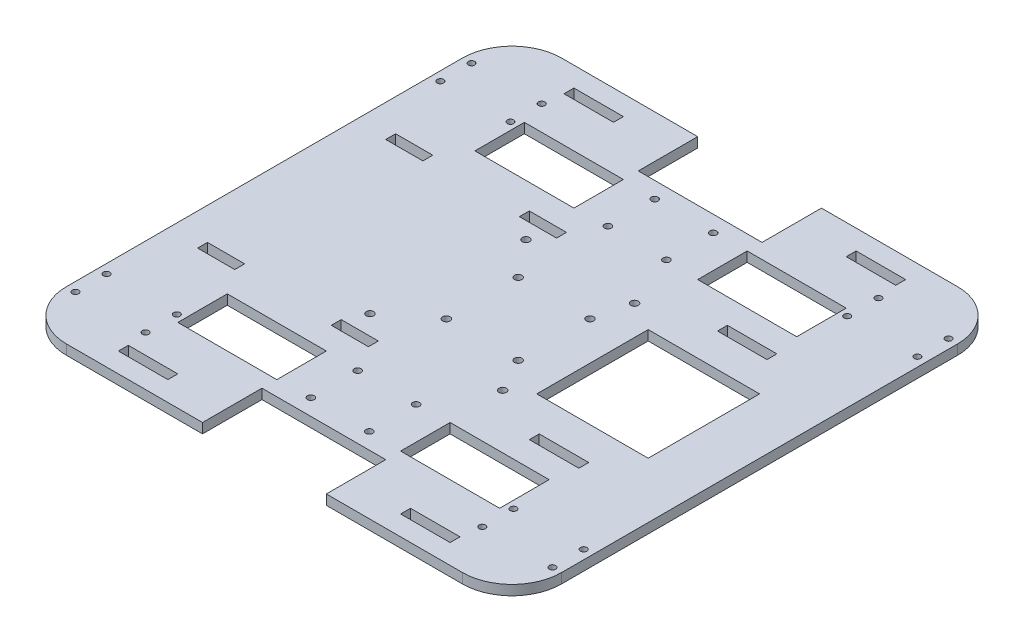
from build123d import *

# Parameters (mm, degrees)
SKETCH1_W               = 254
SKETCH1_H               = 254
PLATFORM_BASE_DEPTH     = 5.08
SKETCH9_W               = 25.4
SKETCH9_H               = 5.08
SKETCH9_W_2             = 19.05
CUT_EXTRUDE6_DEPTH      = 180.676950108
SKETCH3_R               = 1.75
CUT_EXTRUDE1_DEPTH      = 180.676950108
SKETCH4_W               = 63.5
SKETCH4_H               = 30.48
CUT_EXTRUDE2_DEPTH      = 180.676950108
CORNER_ROUNDING_R       = 25.4
SKETCH8_W               = 57.15
SKETCH8_H               = 57.15
CUT_EXTRUDE5_DEPTH      = 180.676950108
SKETCH10_W              = 50.8
SKETCH10_H              = 25.4
CUT_EXTRUDE7_DEPTH      = 180.676950108
SKETCH11_R              = 1.905
CUT_EXTRUDE8_DEPTH      = 180.676950108
SKETCH12_R              = 1.905
CUT_EXTRUDE9_DEPTH      = 180.676950108
SKETCH13_R              = 1.651
CUT_EXTRUDE10_DEPTH     = 180.676950108
MIRROR5_COPY_1_SKETCH_R = 1.651
MIRROR5_COPY_1_DEPTH    = 180.676950108
MIRROR5_COPY_2_SKETCH_R = 1.651
MIRROR5_COPY_2_DEPTH    = 180.676950108
MIRROR7_COPY_1_SKETCH_W = 50.8
MIRROR7_COPY_1_SKETCH_H = 25.4
MIRROR7_COPY_1_DEPTH    = 180.676950108
MIRROR7_COPY_2_SKETCH_W = 50.8
MIRROR7_COPY_2_SKETCH_H = 25.4
MIRROR7_COPY_2_DEPTH    = 180.676950108


with BuildPart() as part:
    # Sketch1 → Platform-Base (new body)
    with BuildSketch(Plane(origin=(0, 0, 0), x_dir=(1, 0, 0), z_dir=(0, 1, 0))):
        Rectangle(SKETCH1_W, SKETCH1_H)
    extrude(amount=PLATFORM_BASE_DEPTH)

    # Sketch9 → Cut-Extrude6 (cut, through all)
    with BuildSketch(Plane(origin=(0, 5.08, 0), x_dir=(1, 0, 0), z_dir=(0, 1, 0))):
        with Locations((-72.39, -114.3)):
            Rectangle(SKETCH9_W, SKETCH9_H)
        with Locations((72.39, -114.3)):
            Rectangle(SKETCH9_W, SKETCH9_H)
        with Locations((72.39, 114.3)):
            Rectangle(SKETCH9_W, SKETCH9_H)
        with Locations((-72.39, 114.3)):
            Rectangle(SKETCH9_W, SKETCH9_H)
        with Locations((72.39, -48.26)):
            Rectangle(SKETCH9_W, SKETCH9_H)
        with Locations((72.39, 48.26)):
            Rectangle(SKETCH9_W, SKETCH9_H)
        with Locations((-32.385, 48.26)):
            Rectangle(SKETCH9_W_2, SKETCH9_H)
        with Locations((-100.965, 48.26)):
            Rectangle(SKETCH9_W_2, SKETCH9_H)
        with Locations((-32.385, -48.26)):
            Rectangle(SKETCH9_W_2, SKETCH9_H)
        with Locations((-100.970875941, -48.26)):
            Rectangle(SKETCH9_W_2, SKETCH9_H)
    extrude(amount=-CUT_EXTRUDE6_DEPTH, mode=Mode.SUBTRACT)

    # Sketch3 → Cut-Extrude1 (cut, through all)
    with BuildSketch(Plane(origin=(0, 5.08, 0), x_dir=(1, 0, 0), z_dir=(0, 1, 0))):
        with Locations((15, -64.2)):
            Circle(SKETCH3_R)
        with Locations((15, -88.2)):
            Circle(SKETCH3_R)
        with Locations((-15, -88.2)):
            Circle(SKETCH3_R)
        with Locations((-15, -64.2)):
            Circle(SKETCH3_R)
    cut_extrude1 = extrude(amount=-CUT_EXTRUDE1_DEPTH, mode=Mode.SUBTRACT)

    # Mirror2: Cut-Extrude1 across plane
    add(cut_extrude1.mirror(Plane.XY), mode=Mode.SUBTRACT)

    # Sketch4 → Cut-Extrude2 (cut, through all)
    with BuildSketch(Plane(origin=(0, 5.08, 0), x_dir=(1, 0, 0), z_dir=(0, 1, 0))):
        with Locations((0, -111.76)):
            Rectangle(SKETCH4_W, SKETCH4_H)
    cut_extrude2 = extrude(amount=-CUT_EXTRUDE2_DEPTH, mode=Mode.SUBTRACT)

    # Mirror3: Cut-Extrude2 across plane
    add(cut_extrude2.mirror(Plane.XY), mode=Mode.SUBTRACT)

    # Corner-Rounding
    corner_rounding_edges = [part.edges().sort_by_distance(p)[0] for p in [
        (-127, 2.54, -127),
        (127, 2.54, -127),
        (127, 2.54, 127),
        (-127, 2.54, 127),
    ]]
    fillet(corner_rounding_edges, radius=CORNER_ROUNDING_R)

    # Sketch8 → Cut-Extrude5 (cut, through all)
    with BuildSketch(Plane(origin=(0, 5.08, 0), x_dir=(1, 0, 0), z_dir=(0, 1, 0))):
        with Locations((69.85, 0)):
            Rectangle(SKETCH8_W, SKETCH8_H)
    extrude(amount=-CUT_EXTRUDE5_DEPTH, mode=Mode.SUBTRACT)

    # Sketch10 → Cut-Extrude7 (cut, through all)
    with BuildSketch(Plane(origin=(0, 5.08, 0), x_dir=(1, 0, 0), z_dir=(0, 1, 0))):
        with Locations((-57.15, -76.2)):
            Rectangle(SKETCH10_W, SKETCH10_H)
    cut_extrude7 = extrude(amount=-CUT_EXTRUDE7_DEPTH, mode=Mode.SUBTRACT)

    # Sketch11 → Cut-Extrude8 (cut, through all)
    with BuildSketch(Plane(origin=(0, 5.08, 0), x_dir=(1, 0, 0), z_dir=(0, 1, 0))):
        with Locations((-15.24, -18.415)):
            Circle(SKETCH11_R)
        with Locations((-15.24, 18.415)):
            Circle(SKETCH11_R)
        with Locations((21.59, 18.415)):
            Circle(SKETCH11_R)
        with Locations((21.59, -18.415)):
            Circle(SKETCH11_R)
    extrude(amount=-CUT_EXTRUDE8_DEPTH, mode=Mode.SUBTRACT)

    # Sketch12 → Cut-Extrude9 (cut, through all)
    with BuildSketch(Plane(origin=(0, 5.08, 0), x_dir=(1, 0, 0), z_dir=(0, 1, 0))):
        with Locations((30.927856532, -35.704925997)):
            Circle(SKETCH12_R)
        with Locations((-37.144143468, -35.704925997)):
            Circle(SKETCH12_R)
        with Locations((26.101856532, 36.778592543)):
            Circle(SKETCH12_R)
        with Locations((-30.032143468, 37.193074003)):
            Circle(SKETCH12_R)
    extrude(amount=-CUT_EXTRUDE9_DEPTH, mode=Mode.SUBTRACT)

    # Sketch13 → Cut-Extrude10 (cut, through all)
    with BuildSketch(Plane(origin=(0, 5.08, 0), x_dir=(1, 0, 0), z_dir=(0, 1, 0))):
        with Locations((-86.36, -101.6)):
            Circle(SKETCH13_R)
        with Locations((-122.36, -101.6)):
            Circle(SKETCH13_R)
        with Locations((-122.36, -85.6)):
            Circle(SKETCH13_R)
        with Locations((-86.36, -85.6)):
            Circle(SKETCH13_R)
    cut_extrude10 = extrude(amount=-CUT_EXTRUDE10_DEPTH, mode=Mode.SUBTRACT)

    # Mirror4: Cut-Extrude10 across plane
    add(cut_extrude10.mirror(Plane.XY), mode=Mode.SUBTRACT)

    # Mirror5 copy 1 sketch → Mirror5 copy 1 (cut, through all)
    with BuildSketch(Plane(origin=(0, 5.08, 0), x_dir=(-1, 0, 0), z_dir=(0, 1, 0))):
        with Locations((-86.36, -101.6)):
            Circle(MIRROR5_COPY_1_SKETCH_R)
        with Locations((-122.36, -101.6)):
            Circle(MIRROR5_COPY_1_SKETCH_R)
        with Locations((-122.36, -85.6)):
            Circle(MIRROR5_COPY_1_SKETCH_R)
        with Locations((-86.36, -85.6)):
            Circle(MIRROR5_COPY_1_SKETCH_R)
    extrude(amount=-MIRROR5_COPY_1_DEPTH, mode=Mode.SUBTRACT)

    # Mirror5 copy 2 sketch → Mirror5 copy 2 (cut, through all)
    with BuildSketch(Plane(origin=(0, 5.08, 0), x_dir=(-1, 0, 0), z_dir=(0, 1, 0))):
        with Locations((-86.36, 101.6)):
            Circle(MIRROR5_COPY_2_SKETCH_R)
        with Locations((-122.36, 101.6)):
            Circle(MIRROR5_COPY_2_SKETCH_R)
        with Locations((-122.36, 85.6)):
            Circle(MIRROR5_COPY_2_SKETCH_R)
        with Locations((-86.36, 85.6)):
            Circle(MIRROR5_COPY_2_SKETCH_R)
    extrude(amount=-MIRROR5_COPY_2_DEPTH, mode=Mode.SUBTRACT)

    # Mirror6: Cut-Extrude7 across plane
    add(cut_extrude7.mirror(Plane(origin=(0, 0, 0), x_dir=(0, 0, 1), z_dir=(1, 0, 0))), mode=Mode.SUBTRACT)

    # Mirror7 copy 1 sketch → Mirror7 copy 1 (cut, through all)
    with BuildSketch(Plane(origin=(0, 5.08, 0), x_dir=(-1, 0, 0), z_dir=(0, 1, 0))):
        with Locations((-57.15, -76.2)):
            Rectangle(MIRROR7_COPY_1_SKETCH_W, MIRROR7_COPY_1_SKETCH_H)
    extrude(amount=-MIRROR7_COPY_1_DEPTH, mode=Mode.SUBTRACT)

    # Mirror7 copy 2 sketch → Mirror7 copy 2 (cut, through all)
    with BuildSketch(Plane(origin=(0, 5.08, 0), x_dir=(1, 0, 0), z_dir=(0, 1, 0))):
        with Locations((-57.15, 76.2)):
            Rectangle(MIRROR7_COPY_2_SKETCH_W, MIRROR7_COPY_2_SKETCH_H)
    extrude(amount=-MIRROR7_COPY_2_DEPTH, mode=Mode.SUBTRACT)


solid = part.part
